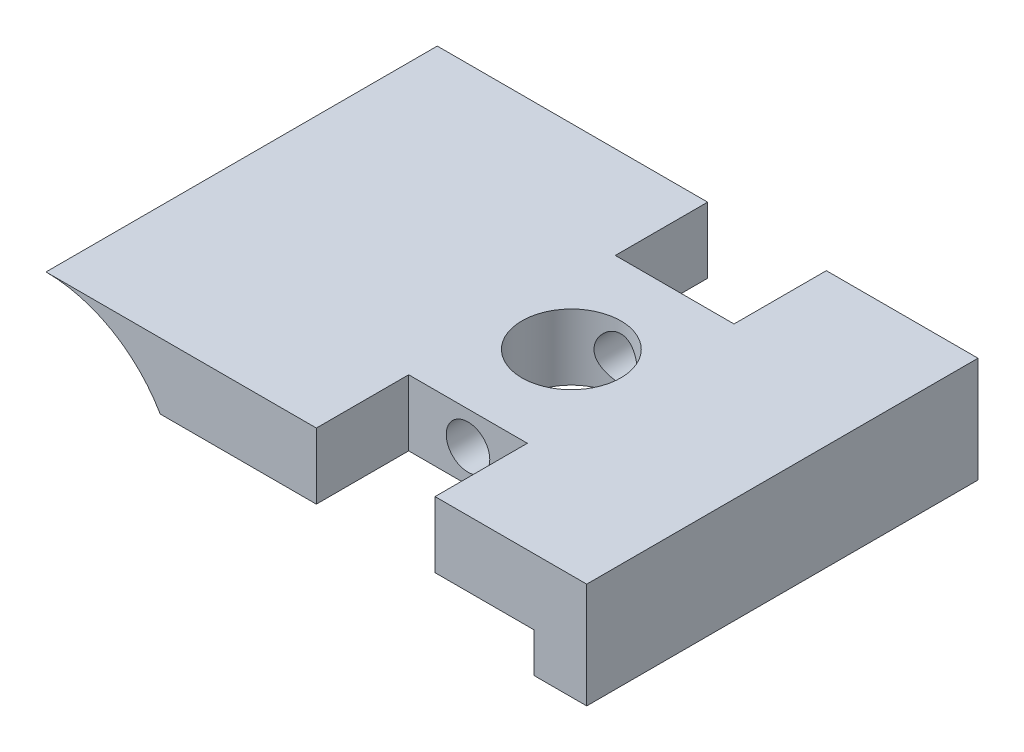
from build123d import *

# Parameters (mm, degrees)
BOSS_EXTRUDE1_DEPTH = 14.835
CUT_EXTRUDE1_REACH  = 38.15
SKETCH4_R           = 1.65
SKETCH4_3_W         = 9
SKETCH4_3_H         = 5
SKETCH4_3_R         = 1.65
CUT_EXTRUDE3_DEPTH  = 7
CUT_EXTRUDE2_REACH  = 27.794
SKETCH5_R           = 3.75
SKETCH6_W           = 4
SKETCH6_H           = 3
BOSS_EXTRUDE2_DEPTH = 29.67


with BuildPart() as part:
    # Sketch3 → Boss-Extrude1 (new, symmetric)
    with BuildSketch(Plane.XY):
        with BuildLine():
            Line((-11.839745962, -2.5), (20.5, -2.5))
            Line((20.5, -2.5), (20.5, 2.5))
            Line((20.5, 2.5), (-20.5, 2.5))
            ThreePointArc((-20.5, 2.5), (-15.5, 1.160254038), (-11.839745962, -2.5))
        make_face()
    extrude(amount=BOSS_EXTRUDE1_DEPTH, both=True)

    # Sketch4 → Cut-Extrude1 (cut, up to next)
    with BuildSketch(Plane.XY.offset(14.835), mode=Mode.PRIVATE) as cut_extrude1_sk1:
        with Locations((4.5, 0)):
            Circle(SKETCH4_R)
    cut_extrude1_tool1 = extrude(cut_extrude1_sk1.sketch, amount=-CUT_EXTRUDE1_REACH, mode=Mode.PRIVATE) & part.part
    add(cut_extrude1_tool1.solids().sort_by_distance((4.5, 0, 14.835))[0], mode=Mode.SUBTRACT)

    # Sketch4<3> → Cut-Extrude3 (cut)
    with BuildSketch(Plane.XY.offset(14.835)):
        with Locations((4.5, 0)):
            Rectangle(SKETCH4_3_W, SKETCH4_3_H)
        with Locations((4.5, 0)):
            Circle(SKETCH4_3_R, mode=Mode.SUBTRACT)
    cut_extrude3 = extrude(amount=-CUT_EXTRUDE3_DEPTH, mode=Mode.SUBTRACT)

    # Mirror1: Cut-Extrude3 across plane
    add(cut_extrude3.mirror(Plane.XY), mode=Mode.SUBTRACT)

    # Sketch5 → Cut-Extrude2 (cut, up to next)
    with BuildSketch(Plane(origin=(0, 2.5, 0), x_dir=(1, 0, 0), z_dir=(0, 1, 0)), mode=Mode.PRIVATE) as cut_extrude2_sk1:
        with Locations(Location((4.5, 0, 0), (0, 0, 270))):
            Circle(SKETCH5_R)
    cut_extrude2_tool1 = extrude(cut_extrude2_sk1.sketch, amount=-CUT_EXTRUDE2_REACH, mode=Mode.PRIVATE) & part.part
    add(cut_extrude2_tool1.solids().sort_by_distance((4.5, 2.5, 0))[0], mode=Mode.SUBTRACT)

    # Sketch6 → Boss-Extrude2 (add)
    with BuildSketch(Plane.XY.offset(14.835)):
        with Locations((18.5, -4)):
            Rectangle(SKETCH6_W, SKETCH6_H)
    extrude(amount=-BOSS_EXTRUDE2_DEPTH)


solid = part.part
